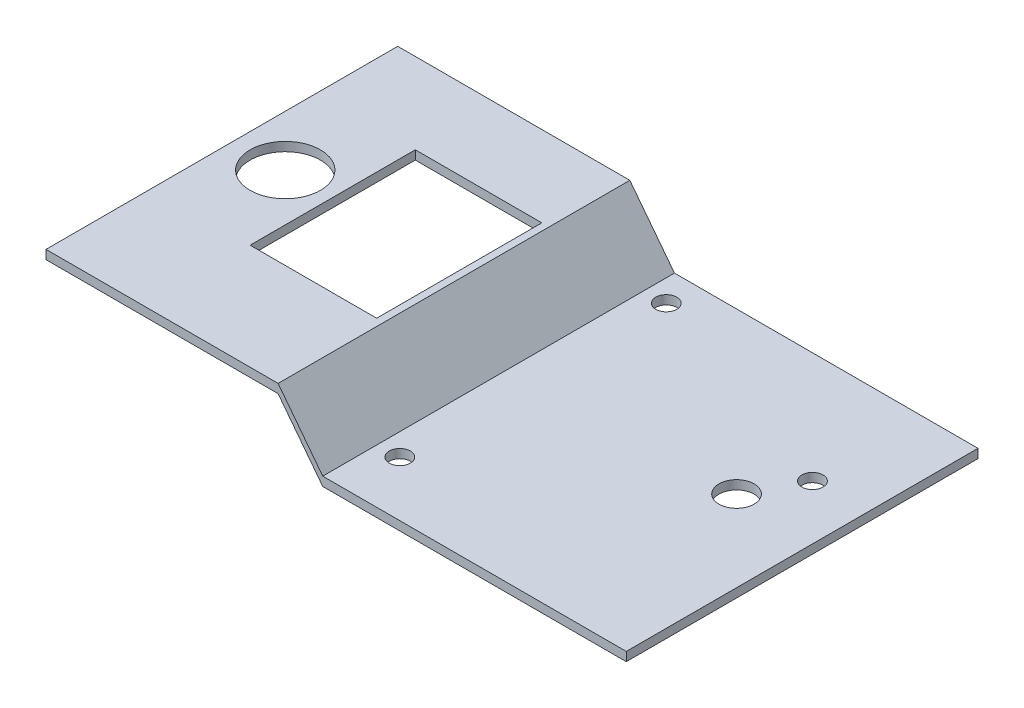
from build123d import *

# Parameters (mm, degrees)
BOSS_EXTRUDE1_DEPTH      = 99.06
BOSS_EXTRUDE1_DEPTH_BACK = 1.016
SKETCH2_R                = 3
SKETCH2_R_2              = 10
SKETCH2_R_3              = 5
SKETCH2_W                = 36
SKETCH2_H                = 47
CUT_EXTRUDE1_DEPTH       = 194.478154064


with BuildPart() as part:
    # Sketch1 → Boss-Extrude1 (new, two sides: drawn at the far end of the back side and taken through both)
    with BuildSketch(Plane.XY.offset(-BOSS_EXTRUDE1_DEPTH_BACK)):
        Polygon((165.1, -13.97), (78.74, -13.97), (66.04, 2.54), (0, 2.54), (0, 0), (66.04, 0), (78.74, -16.51), (165.1, -16.51), align=None)
    extrude(amount=BOSS_EXTRUDE1_DEPTH + BOSS_EXTRUDE1_DEPTH_BACK)

    # Sketch2 → Cut-Extrude1 (cut, through all)
    with BuildSketch(Plane(origin=(0, 2.54, 0), x_dir=(1, 0, 0), z_dir=(0, 1, 0))):
        with Locations(Location((85, -7.584, 0), (0, 0, 270))):
            Circle(SKETCH2_R)
        with Locations(Location((85, -83.384, 0), (0, 0, 270))):
            Circle(SKETCH2_R)
        with Locations(Location((149.6, -30.584, 0), (0, 0, 270))):
            Circle(SKETCH2_R)
        with Locations(Location((14.5, -45.484, 0), (0, 0, 270))):
            Circle(SKETCH2_R_2)
        with Locations(Location((142, -44.584, 0), (0, 0, 270))):
            Circle(SKETCH2_R_3)
        with Locations((46, -45.484)):
            Rectangle(SKETCH2_W, SKETCH2_H)
    extrude(amount=-CUT_EXTRUDE1_DEPTH, mode=Mode.SUBTRACT)


solid = part.part
